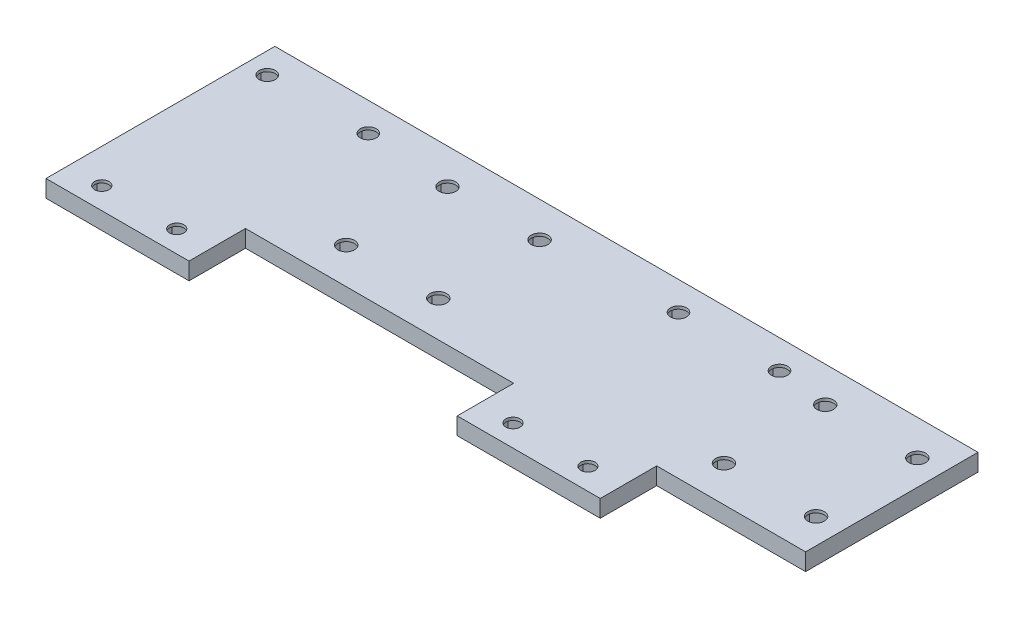
from build123d import *

# Parameters (mm, degrees)
SKETCH1_W           = 140
SKETCH1_H           = 40
BOSS_EXTRUDE1_DEPTH = 3
SKETCH2_R           = 1.4
SKETCH2_R_2         = 1.25
SKETCH2_R_3         = 1.45
CUT_EXTRUDE1_DEPTH  = 146.633100633
CUT_EXTRUDE2_DEPTH  = 2.5
SKETCH5_W           = 46.87
SKETCH5_H           = 9.866874784
CUT_EXTRUDE4_DEPTH  = 146.633100633


with BuildPart() as part:
    # Sketch1 → Boss-Extrude1 (new body)
    with BuildSketch(Plane(origin=(0, 0, 0), x_dir=(1, 0, 0), z_dir=(0, 1, 0))):
        with Locations((70, 20)):
            Rectangle(SKETCH1_W, SKETCH1_H)
    extrude(amount=BOSS_EXTRUDE1_DEPTH)

    # Sketch2 → Cut-Extrude1 (cut, through all)
    with BuildSketch(Plane.XZ):
        with Locations(Location((3.675, -35, 0), (0, 0, 270))):
            Circle(SKETCH2_R)
        with Locations(Location((21.325, -35, 0), (0, 0, 270))):
            Circle(SKETCH2_R)
        with Locations(Location((5.95, -3.8, 0), (0, 0, 270))):
            Circle(SKETCH2_R_2)
        with Locations(Location((19.05, -3.8, 0), (0, 0, 270))):
            Circle(SKETCH2_R_2)
        with Locations(Location((36.32, -33.85, 0), (0, 0, 270))):
            Circle(SKETCH2_R_3)
        with Locations(Location((52.42, -33.85, 0), (0, 0, 270))):
            Circle(SKETCH2_R_3)
        with Locations(Location((52.42, -16.15, 0), (0, 0, 270))):
            Circle(SKETCH2_R_3)
        with Locations(Location((36.32, -16.15, 0), (0, 0, 270))):
            Circle(SKETCH2_R_3)
        with Locations(Location((75.545, -35, 0), (0, 0, 270))):
            Circle(SKETCH2_R)
        with Locations(Location((93.195, -35, 0), (0, 0, 270))):
            Circle(SKETCH2_R)
        with Locations(Location((77.82, -3.8, 0), (0, 0, 270))):
            Circle(SKETCH2_R_2)
        with Locations(Location((90.92, -3.8, 0), (0, 0, 270))):
            Circle(SKETCH2_R_2)
        with Locations(Location((102.342999781, -33.85, 0), (0, 0, 270))):
            Circle(SKETCH2_R_3)
        with Locations(Location((118.442999781, -33.85, 0), (0, 0, 270))):
            Circle(SKETCH2_R_3)
        with Locations(Location((102.342999781, -16.15, 0), (0, 0, 270))):
            Circle(SKETCH2_R_3)
        with Locations(Location((118.442999781, -16.15, 0), (0, 0, 270))):
            Circle(SKETCH2_R_3)
    extrude(amount=-CUT_EXTRUDE1_DEPTH, mode=Mode.SUBTRACT)

    # Sketch3 → Cut-Extrude2 (cut)
    with BuildSketch(Plane.XZ):
        Polygon((8, -4.983568052), (8, -2.616431948), (5.95, -1.432863896), (3.9, -2.616431948), (3.9, -4.983568052), (5.95, -6.167136104), align=None)
        Polygon((21.1, -4.983568052), (21.1, -2.616431948), (19.05, -1.432863896), (17, -2.616431948), (17, -4.983568052), (19.05, -6.167136104), align=None)
        Polygon((6.325, -36.529978213), (6.325, -33.470021787), (3.675, -31.940043573), (1.025, -33.470021787), (1.025, -36.529978213), (3.675, -38.059956427), align=None)
        Polygon((21.325, -38.059956427), (23.975, -36.529978213), (23.975, -33.470021787), (21.325, -31.940043573), (18.675, -33.470021787), (18.675, -36.529978213), align=None)
        Polygon((38.97, -17.679978213), (38.97, -14.620021787), (36.32, -13.090043573), (33.67, -14.620021787), (33.67, -17.679978213), (36.32, -19.209956427), align=None)
        Polygon((52.42, -19.209956427), (55.07, -17.679978213), (55.07, -14.620021787), (52.42, -13.090043573), (49.77, -14.620021787), (49.77, -17.679978213), align=None)
        Polygon((38.97, -35.379978213), (38.97, -32.320021787), (36.32, -30.790043573), (33.67, -32.320021787), (33.67, -35.379978213), (36.32, -36.909956427), align=None)
        Polygon((55.07, -35.379978213), (55.07, -32.320021787), (52.42, -30.790043573), (49.77, -32.320021787), (49.77, -35.379978213), (52.42, -36.909956427), align=None)
        Polygon((78.195, -33.470021787), (75.545, -31.940043573), (72.895, -33.470021787), (72.895, -36.529978213), (75.545, -38.059956427), (78.195, -36.529978213), align=None)
        Polygon((95.845, -36.529978213), (95.845, -33.470021787), (93.195, -31.940043573), (90.545, -33.470021787), (90.545, -36.529978213), (93.195, -38.059956427), align=None)
        Polygon((90.92, -6.167136104), (92.97, -4.983568052), (92.97, -2.616431948), (90.92, -1.432863896), (88.87, -2.616431948), (88.87, -4.983568052), align=None)
        Polygon((79.87, -4.983568052), (79.87, -2.616431948), (77.82, -1.432863896), (75.77, -2.616431948), (75.77, -4.983568052), (77.82, -6.167136104), align=None)
        Polygon((118.442999781, -30.790043573), (115.792999781, -32.320021787), (115.792999781, -35.379978213), (118.442999781, -36.909956427), (121.092999781, -35.379978213), (121.092999781, -32.320021787), align=None)
        Polygon((102.342999781, -30.790043573), (99.692999781, -32.320021787), (99.692999781, -35.379978213), (102.342999781, -36.909956427), (104.992999781, -35.379978213), (104.992999781, -32.320021787), align=None)
        Polygon((102.342999781, -13.090043573), (99.692999781, -14.620021787), (99.692999781, -17.679978213), (102.342999781, -19.209956427), (104.992999781, -17.679978213), (104.992999781, -14.620021787), align=None)
        Polygon((118.442999781, -13.090043573), (115.792999781, -14.620021787), (115.792999781, -17.679978213), (118.442999781, -19.209956427), (121.092999781, -17.679978213), (121.092999781, -14.620021787), align=None)
    extrude(amount=-CUT_EXTRUDE2_DEPTH, mode=Mode.SUBTRACT)

    # Sketch5 → Cut-Extrude4 (cut, through all)
    with BuildSketch(Plane(origin=(0, 3, 0), x_dir=(1, 0, 0), z_dir=(0, 1, 0))):
        with Locations((48.435, 4.933437392)):
            Rectangle(SKETCH5_W, SKETCH5_H)
        Polygon((96.87, 9.866874784), (122.892999781, 9.866874784), (122.892999781, 40), (140, 40), (140, 9.866874784), (140, 0), (96.87, 0), align=None)
    extrude(amount=-CUT_EXTRUDE4_DEPTH, mode=Mode.SUBTRACT)


solid = part.part
